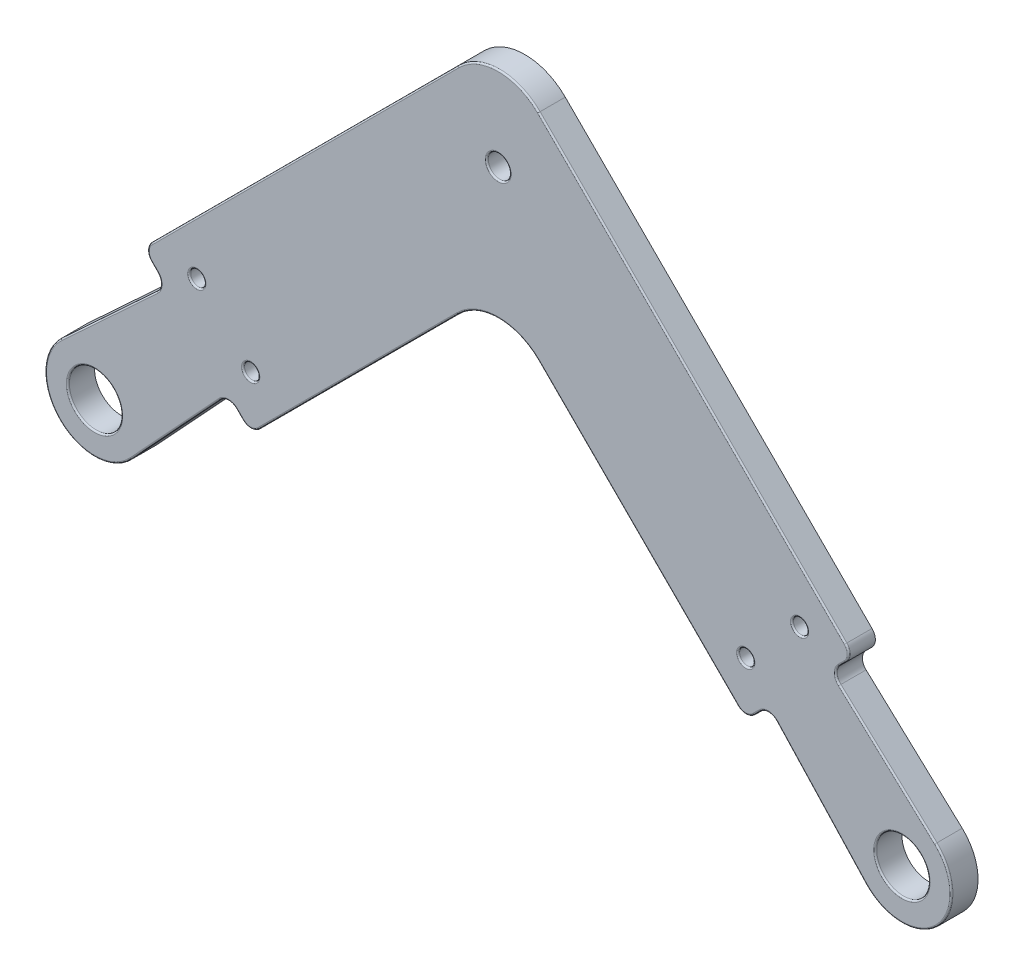
from build123d import *

# Parameters (mm, degrees)
SKETCH5_R           = 3.5
SKETCH5_R_2         = 1
SKETCH5_R_3         = 1.5
BOSS_EXTRUDE1_DEPTH = 3.5
FILLET1_R           = 7.5
FILLET2_R           = 1.5
FILLET3_R           = 0.2


with BuildPart() as part:
    # Sketch5 → Boss-Extrude1 (new body)
    with BuildSketch(Plane.XY):
        with BuildLine():
            Line((4.418459759, 4.76730672), (-9.345742325, 17.52431536))
            Line((-9.345742325, 17.52431536), (-6.363961031, 20.506096654))
            Line((-6.363961031, 20.506096654), (-53.015361965, 67.157497589))
            Line((-53.015361965, 67.157497589), (-99.666762899, 20.506096654))
            Line((-99.666762899, 20.506096654), (-96.684981605, 17.52431536))
            Line((-96.684981605, 17.52431536), (-110.449183688, 4.76730672))
            ThreePointArc((-110.449183688, 4.76730672), (-110.626918007, -4.596194078), (-101.26341721, -4.418459759))
            Line((-101.26341721, -4.418459759), (-88.506408569, 9.345742325))
            Line((-88.506408569, 9.345742325), (-85.524627275, 6.363961031))
            Line((-85.524627275, 6.363961031), (-53.015361965, 38.873226341))
            Line((-53.015361965, 38.873226341), (-20.506096654, 6.363961031))
            Line((-20.506096654, 6.363961031), (-17.52431536, 9.345742325))
            Line((-17.52431536, 9.345742325), (-4.76730672, -4.418459759))
            ThreePointArc((-4.76730672, -4.418459759), (4.596194078, -4.596194078), (4.418459759, 4.76730672))
        make_face()
        Circle(SKETCH5_R, mode=Mode.SUBTRACT)
        with Locations((-106.03072393, 0)):
            Circle(SKETCH5_R, mode=Mode.SUBTRACT)
        with Locations((-92.595695087, 20.506096654)):
            Circle(SKETCH5_R_2, mode=Mode.SUBTRACT)
        with Locations((-53.015361965, 53.015361965)):
            Circle(SKETCH5_R_3, mode=Mode.SUBTRACT)
        with Locations((-20.506096654, 13.435028843)):
            Circle(SKETCH5_R_2, mode=Mode.SUBTRACT)
        with Locations((-13.435028843, 20.506096654)):
            Circle(SKETCH5_R_2, mode=Mode.SUBTRACT)
        with Locations((-85.524627275, 13.435028843)):
            Circle(SKETCH5_R_2, mode=Mode.SUBTRACT)
    extrude(amount=BOSS_EXTRUDE1_DEPTH)

    # Fillet1
    fillet1_edges = [part.edges().sort_by_distance(p)[0] for p in [
        (-53.015361965, 67.157497589, 1.75),
        (-53.015361965, 38.873226341, 1.75),
    ]]
    fillet(fillet1_edges, radius=FILLET1_R)

    # Fillet2
    fillet2_edges = [part.edges().sort_by_distance(p)[0] for p in [
        (-88.506408569, 9.345742325, 1.75),
        (-96.684981605, 17.52431536, 1.75),
        (-99.666762899, 20.506096654, 1.75),
        (-6.363961031, 20.506096654, 1.75),
        (-9.345742325, 17.52431536, 1.75),
        (-17.52431536, 9.345742325, 1.75),
        (-20.506096654, 6.363961031, 1.75),
        (-85.524627275, 6.363961031, 1.75),
    ]]
    fillet(fillet2_edges, radius=FILLET2_R)

    # Fillet3
    fillet3_edges = [part.edges().sort_by_distance(p)[0] for p in [
        (-97.34761728, 17.536893252, 3.5),
        (-88.493830678, 8.68310665, 3.5),
        (-17.536893252, 8.68310665, 3.5),
        (-8.68310665, 17.536893252, 3.5),
        (4.596194078, -4.596194078, 3.5),
        (-1.892280802, 10.616259777, 3.5),
        (-3.5, 0, 3.5),
        (-109.53072393, 0, 3.5),
        (-93.595695087, 20.506096654, 3.5),
        (-54.515361965, 53.015361965, 3.5),
        (-21.506096654, 13.435028843, 3.5),
        (-110.626918007, -4.596194078, 3.5),
        (-14.435028843, 20.506096654, 3.5),
        (-95.414464153, 1.892280802, 3.5),
        (-86.524627275, 13.435028843, 3.5),
        (-34.639408966, 20.497273342, 3.5),
        (-78.462382775, 41.710476778, 3.5),
        (-53.015361965, 64.050895871, 3.5),
        (-53.015361965, 35.766624623, 3.5),
        (-98.196394841, 19.035728597, 3.5),
        (-27.568341154, 41.710476778, 3.5),
        (-104.138443128, 10.616259777, 3.5),
        (-86.994995333, 7.834329088, 3.5),
        (-71.391314964, 20.497273342, 3.5),
        (-19.035728597, 7.834329088, 3.5),
        (-10.616259777, 1.892280802, 3.5),
        (-7.834329088, 19.035728597, 3.5),
        (-6.985281374, 20.506096654, 3.5),
        (-20.506096654, 6.985281374, 3.5),
        (-85.524627275, 6.985281374, 3.5),
        (-99.045442555, 20.506096654, 3.5),
    ]]
    fillet(fillet3_edges, radius=FILLET3_R)


solid = part.part
